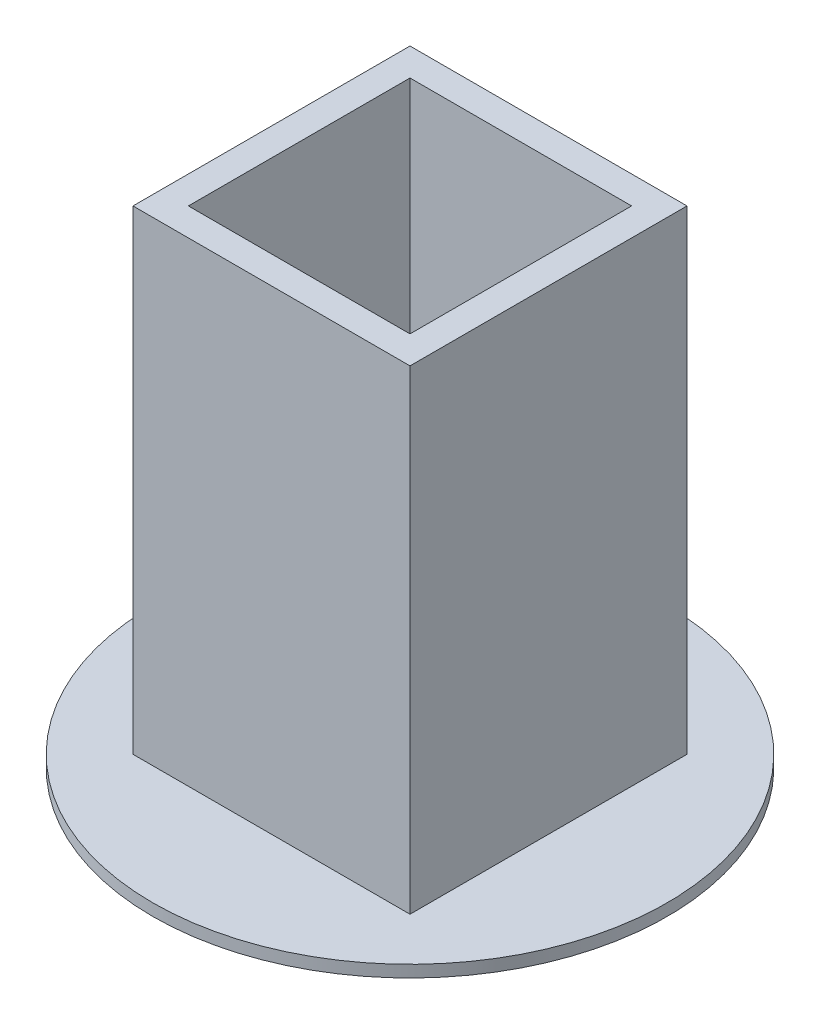
from build123d import *

# Parameters (mm, degrees)
SKETCH_1_R      = 65
EXTRUDE_1_DEPTH = 3
SKETCH_2_W      = 70
SKETCH_2_H      = 70
EXTRUDE_2_DEPTH = 120
SHELL_2_T       = -7


with BuildPart() as part:
    # 草图1 → 凸台-拉伸1 (new body)
    with BuildSketch(Plane(origin=(0, 0, 0), x_dir=(1, 0, 0), z_dir=(0, 1, 0))):
        with Locations(Location((0, 0, 0), (0, 0, 270))):
            Circle(SKETCH_1_R)
    extrude(amount=EXTRUDE_1_DEPTH)

    # 草图2 → 凸台-拉伸2 (add)
    with BuildSketch(Plane(origin=(0, 3, 0), x_dir=(1, 0, 0), z_dir=(0, 1, 0))):
        Rectangle(SKETCH_2_W, SKETCH_2_H)
    extrude(amount=EXTRUDE_2_DEPTH)

    # 抽壳2
    shell_2_openings = [part.faces().sort_by_distance(p)[0] for p in [
        (0, 123, 0),
    ]]
    offset(amount=SHELL_2_T, openings=shell_2_openings, kind=Kind.INTERSECTION)


solid = part.part
